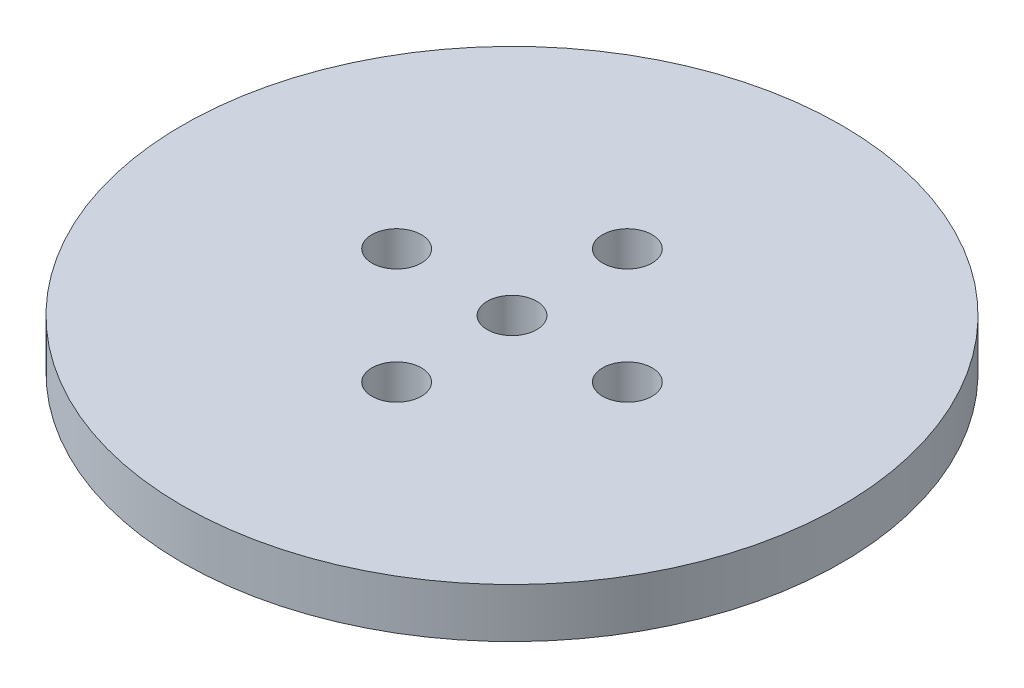
from build123d import *

# Parameters (mm, degrees)
SKETCH_1_R      = 20
SKETCH_1_R_2    = 1.5
EXTRUDE_1_DEPTH = 3


with BuildPart() as part:
    # 草图1 → 凸台-拉伸1 (new body)
    with BuildSketch(Plane(origin=(0, 0, 0), x_dir=(1, 0, 0), z_dir=(0, 1, 0))):
        with Locations(Location((0, 0, 0), (0, 0, 270))):
            Circle(SKETCH_1_R)
        with Locations(Location((0, 7, 0), (0, 0, 270))):
            Circle(SKETCH_1_R_2, mode=Mode.SUBTRACT)
        with Locations(Location((0, 0, 0), (0, 0, 270))):
            Circle(SKETCH_1_R_2, mode=Mode.SUBTRACT)
        with Locations(Location((7, 0, 0), (0, 0, 270))):
            Circle(SKETCH_1_R_2, mode=Mode.SUBTRACT)
        with Locations(Location((-7, 0, 0), (0, 0, 90))):
            Circle(SKETCH_1_R_2, mode=Mode.SUBTRACT)
        with Locations(Location((0, -7, 0), (0, 0, 90))):
            Circle(SKETCH_1_R_2, mode=Mode.SUBTRACT)
    extrude(amount=EXTRUDE_1_DEPTH)


solid = part.part
